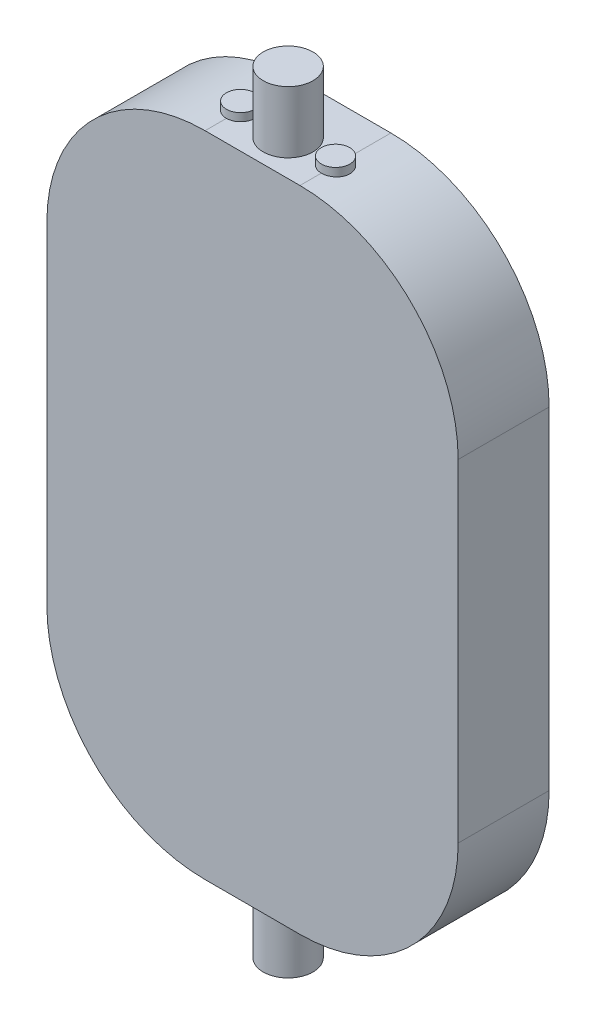
from build123d import *

# Parameters (mm, degrees)
BOSS_EXTRUDE1_DEPTH = 11.5
SKETCH2_R           = 3.15
BOSS_EXTRUDE2_DEPTH = 7.8
SKETCH3_R           = 1.8
BOSS_EXTRUDE3_DEPTH = 1


with BuildPart() as part:
    # Sketch1 → Boss-Extrude1 (new body)
    with BuildSketch(Plane.XY):
        with BuildLine():
            Line((-26, 21), (-26, -21))
            ThreePointArc((-26, -21), (-20.142135624, -35.142135624), (-6, -41))
            Line((-6, -41), (6, -41))
            ThreePointArc((6, -41), (20.142135624, -35.142135624), (26, -21))
            Line((26, -21), (26, 21))
            ThreePointArc((26, 21), (20.142135624, 35.142135624), (6, 41))
            Line((6, 41), (-6, 41))
            ThreePointArc((-6, 41), (-20.142135624, 35.142135624), (-26, 21))
        make_face()
    extrude(amount=BOSS_EXTRUDE1_DEPTH)

    # Sketch2 → Boss-Extrude2 (add)
    with BuildSketch(Plane(origin=(0, 41, 0), x_dir=(1, 0, 0), z_dir=(0, 1, 0))):
        with Locations(Location((0, -7, 0), (0, 0, 90))):
            Circle(SKETCH2_R)
    boss_extrude2 = extrude(amount=BOSS_EXTRUDE2_DEPTH)

    # Sketch3 → Boss-Extrude3 (add, symmetric)
    with BuildSketch(Plane(origin=(0, 41, 0), x_dir=(1, 0, 0), z_dir=(0, 1, 0))):
        with Locations(Location((-6, -7, 0), (0, 0, 270))):
            Circle(SKETCH3_R)
        with Locations(Location((6, -7, 0), (0, 0, 270))):
            Circle(SKETCH3_R)
    boss_extrude3 = extrude(amount=BOSS_EXTRUDE3_DEPTH, both=True)

    # Mirror1: Boss-Extrude2, Boss-Extrude3 across plane
    add(boss_extrude2.mirror(Plane.ZX))
    add(boss_extrude3.mirror(Plane.ZX))


solid = part.part
